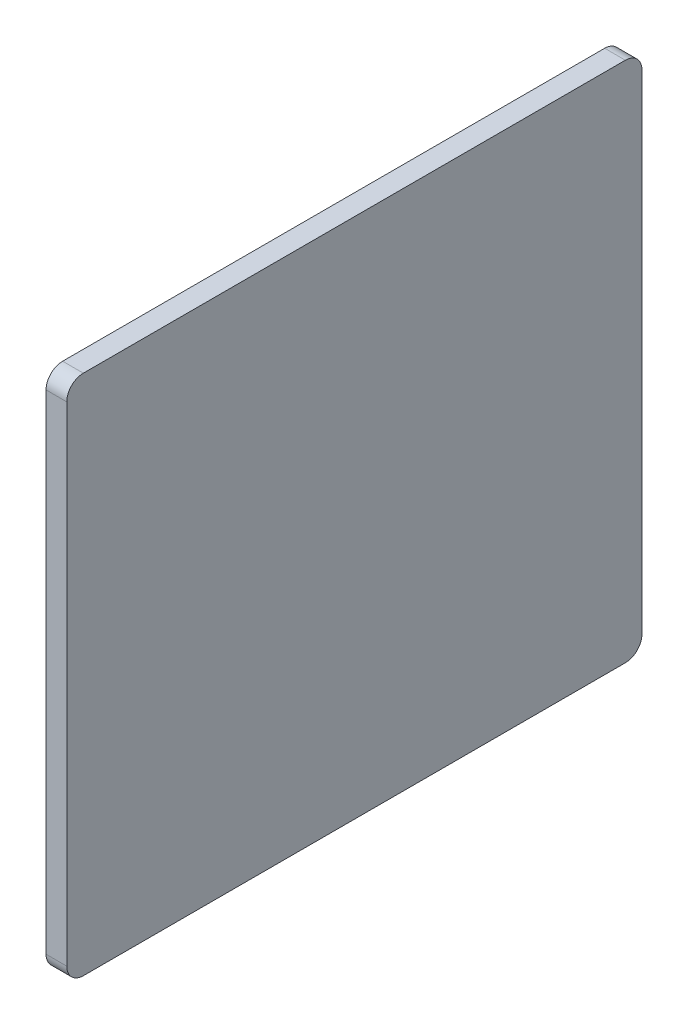
from build123d import *

# Parameters (mm, degrees)
SKETCH1_W           = 88.175
SKETCH1_H           = 80
BOSS_EXTRUDE1_DEPTH = 3.175
FILLET1_R           = 2.54


with BuildPart() as part:
    # Sketch1 → Boss-Extrude1 (new body)
    with BuildSketch(Plane(origin=(0, 0, 0), x_dir=(0, 0, -1), z_dir=(1, 0, 0))):
        Rectangle(SKETCH1_W, SKETCH1_H)
    extrude(amount=BOSS_EXTRUDE1_DEPTH)

    # Fillet1
    fillet1_edges = [part.edges().sort_by_distance(p)[0] for p in [
        (1.5875, 40, 44.0875),
        (1.5875, 40, -44.0875),
        (1.5875, -40, -44.0875),
        (1.5875, -40, 44.0875),
    ]]
    fillet(fillet1_edges, radius=FILLET1_R)


solid = part.part
